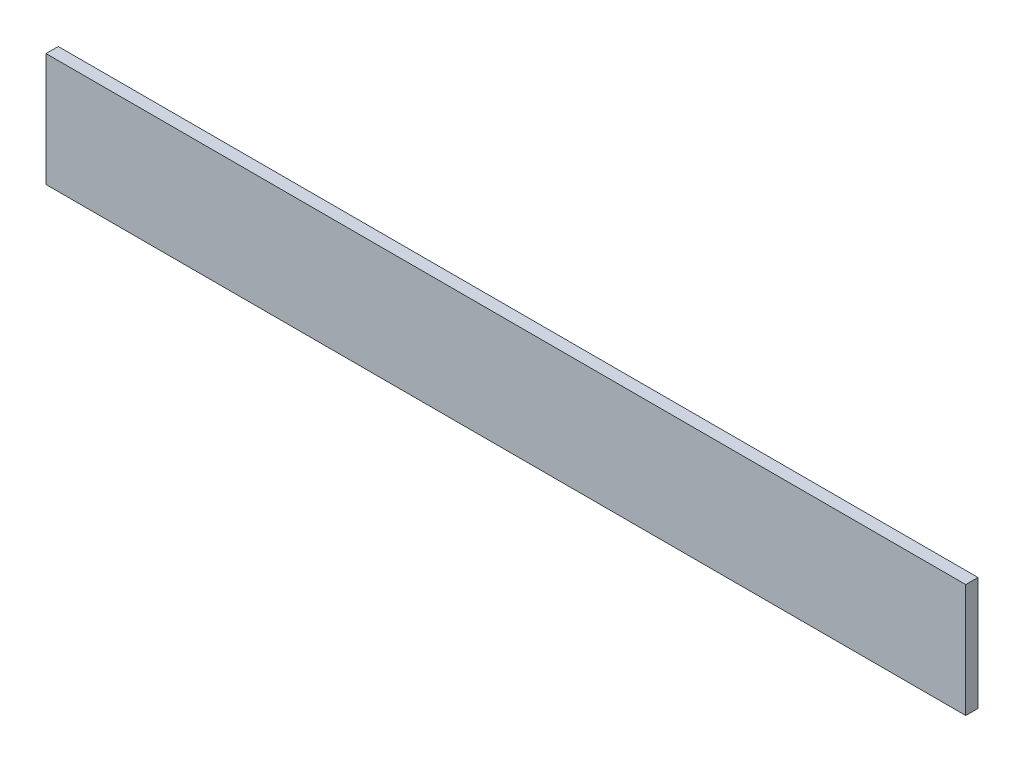
from build123d import *

# Parameters (mm, degrees)
SKETCH1_W           = 300
SKETCH1_H           = 37
BOSS_EXTRUDE1_DEPTH = 4


with BuildPart() as part:
    # Sketch1 → Boss-Extrude1 (new body)
    with BuildSketch(Plane.XY):
        Rectangle(SKETCH1_W, SKETCH1_H)
    extrude(amount=BOSS_EXTRUDE1_DEPTH)


solid = part.part
